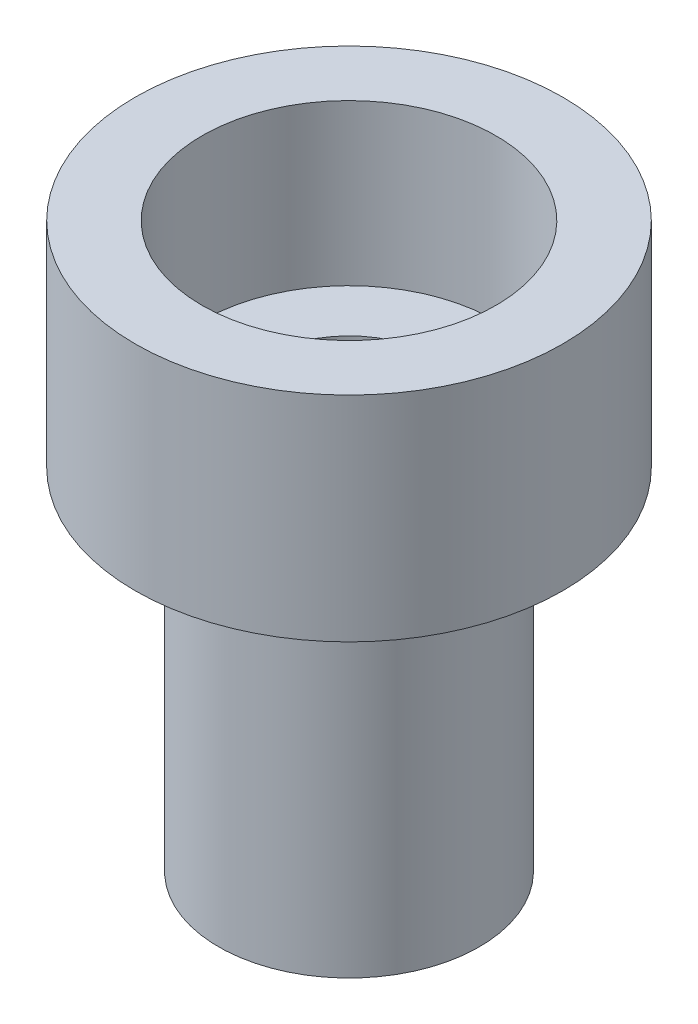
from build123d import *

# Parameters (mm, degrees)
SKETCH1_R           = 4
BOSS_EXTRUDE1_DEPTH = 4
SKETCH2_R           = 2.44
BOSS_EXTRUDE2_DEPTH = 6.55
SKETCH3_R           = 2.75
CUT_EXTRUDE1_DEPTH  = 3
SKETCH4_R           = 1.6
CUT_EXTRUDE2_DEPTH  = 10.434113631


with BuildPart() as part:
    # Sketch1 → Boss-Extrude1 (new body)
    with BuildSketch(Plane(origin=(0, 0, 0), x_dir=(1, 0, 0), z_dir=(0, 1, 0))):
        with Locations(Location((0, 0, 0), (0, 0, 270))):
            Circle(SKETCH1_R)
    extrude(amount=BOSS_EXTRUDE1_DEPTH)

    # Sketch2 → Boss-Extrude2 (add)
    with BuildSketch(Plane.XZ):
        with Locations(Location((0, 0, 0), (0, 0, 270))):
            Circle(SKETCH2_R)
    extrude(amount=BOSS_EXTRUDE2_DEPTH)

    # Sketch3 → Cut-Extrude1 (cut)
    with BuildSketch(Plane(origin=(0, 4, 0), x_dir=(1, 0, 0), z_dir=(0, 1, 0))):
        with Locations(Location((0, 0, 0), (0, 0, 270))):
            Circle(SKETCH3_R)
    extrude(amount=-CUT_EXTRUDE1_DEPTH, mode=Mode.SUBTRACT)

    # Sketch4 → Cut-Extrude2 (cut, through all)
    with BuildSketch(Plane(origin=(0, 1, 0), x_dir=(1, 0, 0), z_dir=(0, 1, 0))):
        with Locations(Location((0, 0, 0), (0, 0, 270))):
            Circle(SKETCH4_R)
    extrude(amount=-CUT_EXTRUDE2_DEPTH, mode=Mode.SUBTRACT)


solid = part.part
